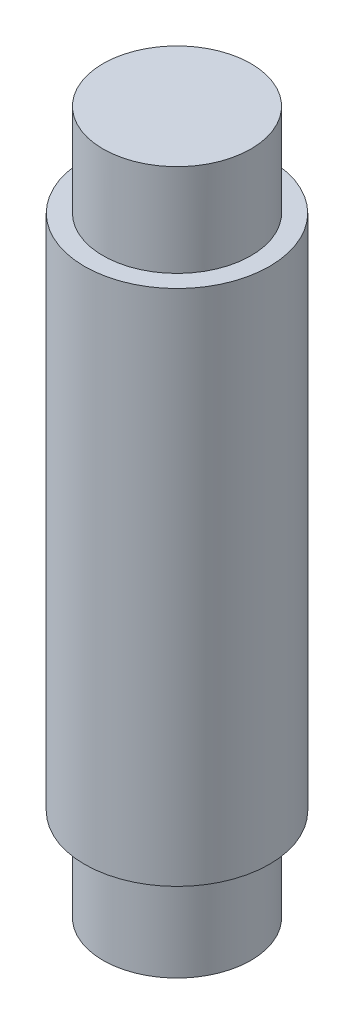
from build123d import *

# Parameters (mm, degrees)
SKETCH1_W           = 2.5
SKETCH1_H           = 14
SKETCH2_R           = 2
BOSS_EXTRUDE1_DEPTH = 2.5
BOSS_EXTRUDE2_START = 2.5
SKETCH3_R           = 2
BOSS_EXTRUDE2_DEPTH = 2.5


with BuildPart() as part:
    # Sketch1 → Revolve-Thin1 (revolve)
    with BuildSketch(Plane.XY, mode=Mode.PRIVATE) as revolve_thin1_sk:
        with Locations((-1.25, 7)):
            Rectangle(SKETCH1_W, SKETCH1_H)
    revolve(revolve_thin1_sk.sketch.rotate(Axis((0, 0, 0), (0, 1, 0)), 270), axis=Axis((0, 0, 0), (0, 1, 0)))

    # Sketch2 → Boss-Extrude1 (add)
    with BuildSketch(Plane(origin=(0, 14, 0), x_dir=(1, 0, 0), z_dir=(0, 1, 0))):
        with Locations(Location((0, 0, 0), (0, 0, 90))):
            Circle(SKETCH2_R)
    extrude(amount=BOSS_EXTRUDE1_DEPTH)

    # Sketch3 → Boss-Extrude2 (add)
    with BuildSketch(Plane(origin=(0, 0, 0), x_dir=(-1, 0, 0), z_dir=(0, -1, 0)).offset(BOSS_EXTRUDE2_START)):
        with Locations(Location((0, 0, 0), (0, 0, 90))):
            Circle(SKETCH3_R)
    extrude(amount=-BOSS_EXTRUDE2_DEPTH)


solid = part.part
